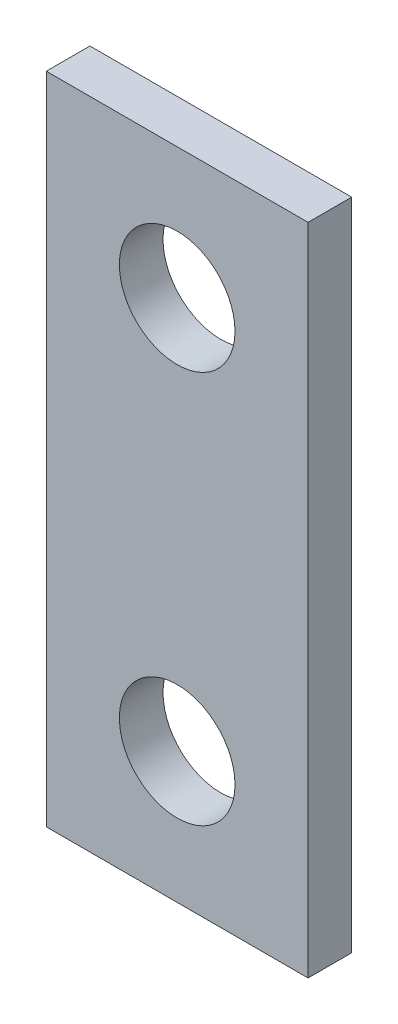
from build123d import *

# Parameters (mm, degrees)
SKETCH_1_W         = 12
SKETCH_1_H         = 30
EXTRUDE_1_DEPTH    = 2
HOLE_WIZARD_M5_1_D = 5.3


with BuildPart() as part:
    # 草图1 → 凸台-拉伸1 (new body)
    with BuildSketch(Plane.XY):
        Rectangle(SKETCH_1_W, SKETCH_1_H)
    extrude(amount=EXTRUDE_1_DEPTH)

    # M5 间隙孔1 (through all)
    with Locations(Plane.XY.offset(2)):
        with Locations((0, -9), (0, 9)):
            Hole(HOLE_WIZARD_M5_1_D / 2)


solid = part.part
